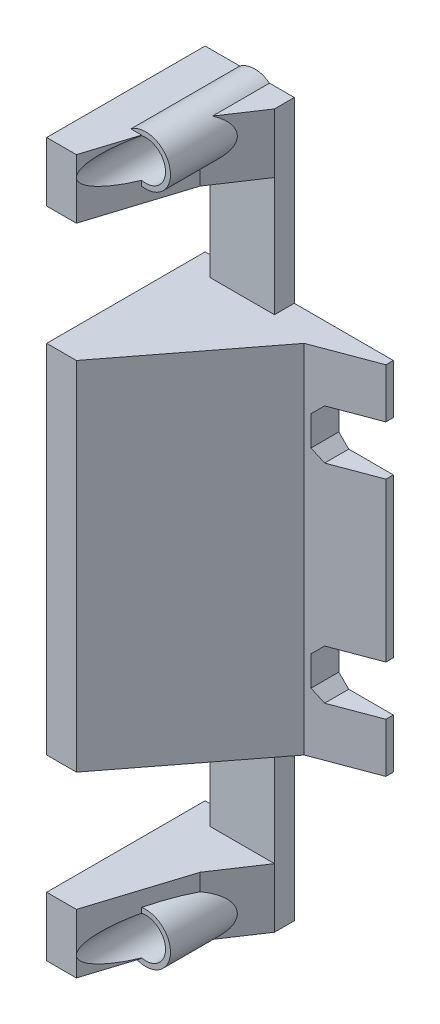
from build123d import *

# Parameters (mm, degrees)
F_4MM_DEPTH             = 4
F_6MM_0_START           = -36
F_6MM_0_DEPTH           = 72
F_6MM_66_START          = 60
F_6MM_66_DEPTH          = 12
F_6MM_66_START_2        = -72
F_6MM_66_2_DEPTH        = 12
SKETCH_5_R              = 1.65
CUT_EXTRUDE_M3_DEPTH    = 4
SKETCH_7_R              = 5
SKETCH_7_R_2            = 1.65
EXTRUDE_D10_DEPTH       = 22
D8_4MM_START            = 4
SKETCH_8_R              = 4
D8_4MM_DEPTH            = 32
CUT_EXTRUDE_14X10_DEPTH = 40


with BuildPart() as part:
    # 草图1 → 加厚侧鞍底梁_4mm (new body)
    with BuildSketch(Plane.XY):
        Polygon((37, -72), (46, -72), (48, -70), (48, 70), (46, 72), (37, 72), (35, 70), (35, -70), align=None)
    extrude(amount=F_4MM_DEPTH)

    # 草图2 → 高侧壁6mm_分段缓降斜面_0 (add)
    with BuildSketch(Plane(origin=(0, 0, 0), x_dir=(1, 0, 0), z_dir=(0, 1, 0)).offset(F_6MM_0_START)):
        Polygon((30, 0), (68, 0), (68, -1.5), (56, -6), (36, -32), (30, -32), align=None)
    extrude(amount=F_6MM_0_DEPTH)

    # 草图3 → 6mm___66 (add)
    with BuildSketch(Plane(origin=(0, 0, 0), x_dir=(1, 0, 0), z_dir=(0, 1, 0)).offset(F_6MM_66_START)):
        Polygon((30, 0), (48, 0), (48, -4), (42, -13), (36, -32), (30, -32), align=None)
    extrude(amount=F_6MM_66_DEPTH)

    # 草图4 → 6mm___-66 2 (add)
    with BuildSketch(Plane(origin=(0, 0, 0), x_dir=(1, 0, 0), z_dir=(0, 1, 0)).offset(F_6MM_66_START_2)):
        Polygon((30, 0), (48, 0), (48, -4), (42, -13), (36, -32), (30, -32), align=None)
    extrude(amount=F_6MM_66_2_DEPTH)

    # 草图5 → 侧鞍M3贯穿固定孔 (cut)
    with BuildSketch(Plane.XY):
        with Locations((40, -68)):
            Circle(SKETCH_5_R)
        with Locations((40, 68)):
            Circle(SKETCH_5_R)
    extrude(amount=CUT_EXTRUDE_M3_DEPTH, mode=Mode.SUBTRACT)

    # 草图7 → 螺丝沉台局部加强圈_D10 (add)
    # profile 1 of 2: a face of its own
    with BuildSketch(Plane.XY):
        with Locations((40, -68)):
            Circle(SKETCH_7_R)
        with Locations((40, -68)):
            Circle(SKETCH_7_R_2, mode=Mode.SUBTRACT)
    # profile 2 of 2: a face of its own
    with BuildSketch(Plane.XY):
        with Locations((40, 68)):
            Circle(SKETCH_7_R)
        with Locations((40, 68)):
            Circle(SKETCH_7_R_2, mode=Mode.SUBTRACT)
    extrude(amount=EXTRUDE_D10_DEPTH)

    # 草图8 → 螺丝头及工具沉台_D8_保留4mm底 (cut)
    with BuildSketch(Plane.XY.offset(D8_4MM_START)):
        with Locations(Location((40, -68, 0), (0, 0, 180))):
            Circle(SKETCH_8_R)
        with Locations(Location((40, 68, 0), (0, 0, 180))):
            Circle(SKETCH_8_R)
    extrude(amount=D8_4MM_DEPTH, mode=Mode.SUBTRACT)

    # 草图9 → 板内钢索孔侧向敞口避让_14x10 (cut)
    with BuildSketch(Plane.XY):
        Polygon((59, 16), (69, 16), (71, 18), (71, 24), (69, 26), (59, 26), (57, 24), (57, 18), align=None)
        Polygon((59, -26), (69, -26), (71, -24), (71, -18), (69, -16), (59, -16), (57, -18), (57, -24), align=None)
    extrude(amount=CUT_EXTRUDE_14X10_DEPTH, mode=Mode.SUBTRACT)


solid = part.part
